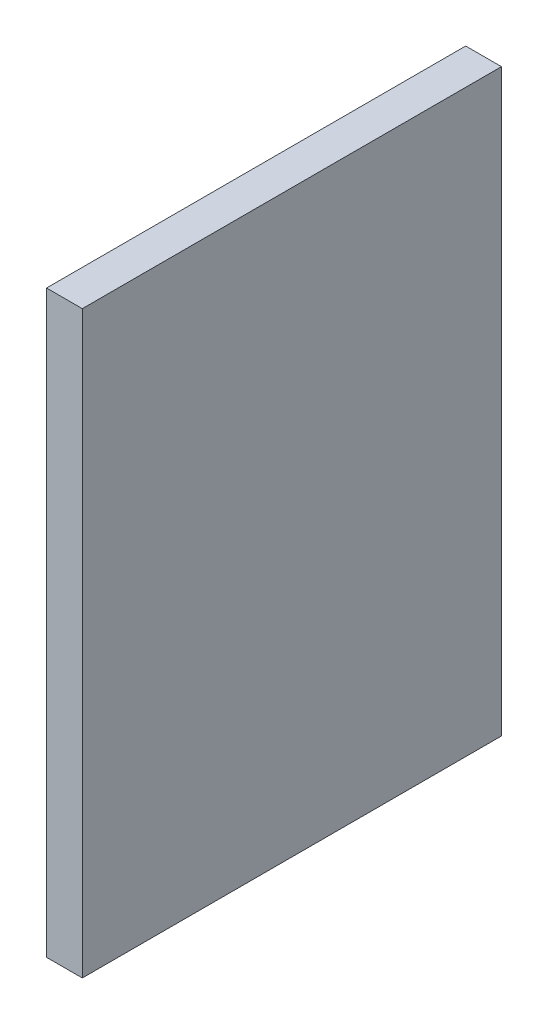
from build123d import *

# Parameters (mm, degrees)
SKETCH_1_W      = 50.4
SKETCH_1_H      = 69.7
EXTRUDE_1_DEPTH = 4.3


with BuildPart() as part:
    # 草图1 → 凸台-拉伸1 (new body)
    with BuildSketch(Plane(origin=(0, 0, 0), x_dir=(0, 0, -1), z_dir=(1, 0, 0))):
        Rectangle(SKETCH_1_W, SKETCH_1_H)
    extrude(amount=EXTRUDE_1_DEPTH)


solid = part.part
